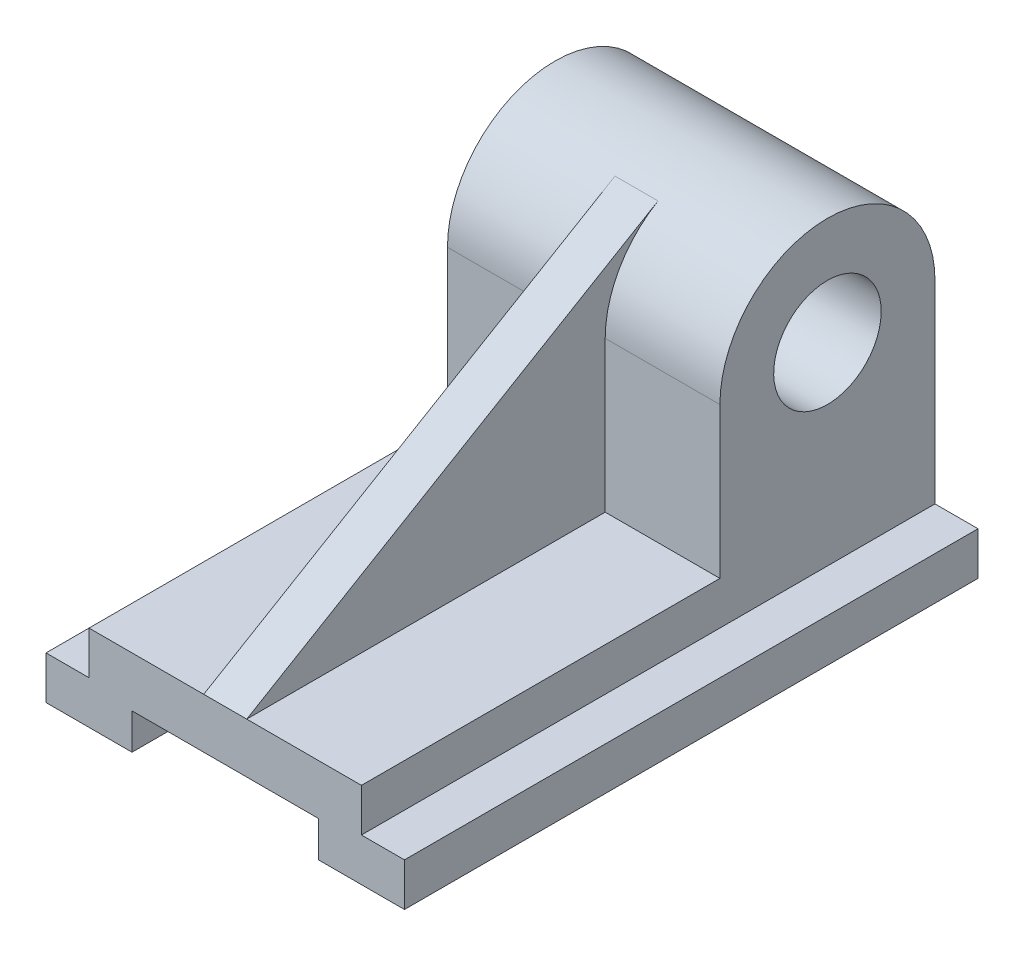
from build123d import *

# Parameters (mm, degrees)
BOSS_EXTRUDE1_DEPTH = 80
SKETCH2_W           = 76
SKETCH2_H           = 60
BOSS_EXTRUDE2_DEPTH = 42
SKETCH3_R           = 30
BOSS_EXTRUDE4_DEPTH = 76
SKETCH5_R           = 15
CUT_EXTRUDE3_DEPTH  = 146.602197786
RIB1_REACH          = 128.317
SKETCH6_WALL_W      = 387.915768988
SKETCH6_WALL_H      = 12


with BuildPart() as part:
    # Sketch1 → Boss-Extrude1 (new, symmetric)
    with BuildSketch(Plane.XY):
        Polygon((38, 12), (-38, 12), (-38, 0), (-50, 0), (-50, -12), (-26, -12), (-26, -2), (26, -2), (26, -12), (50, -12), (50, 0), (38, 0), align=None)
    extrude(amount=BOSS_EXTRUDE1_DEPTH, both=True)

    # Sketch2 → Boss-Extrude2 (add)
    with BuildSketch(Plane(origin=(0, 12, 0), x_dir=(1, 0, 0), z_dir=(0, 1, 0))):
        with Locations((0, 50)):
            Rectangle(SKETCH2_W, SKETCH2_H)
    extrude(amount=BOSS_EXTRUDE2_DEPTH)

    # Sketch3 → Boss-Extrude4 (add)
    with BuildSketch(Plane(origin=(38, 0, 0), x_dir=(0, 0, -1), z_dir=(1, 0, 0))):
        with Locations((50, 54)):
            Circle(SKETCH3_R)
    extrude(amount=-BOSS_EXTRUDE4_DEPTH)

    # Sketch5 → Cut-Extrude3 (cut, through all)
    with BuildSketch(Plane(origin=(38, 0, 0), x_dir=(0, 0, -1), z_dir=(1, 0, 0))):
        with Locations(Location((50, 54, 0), (0, 0, 90))):
            Circle(SKETCH5_R)
    extrude(amount=-CUT_EXTRUDE3_DEPTH, mode=Mode.SUBTRACT)

    # Sketch6 wall → Rib1 (add, up to next)
    with BuildSketch(Plane(origin=(0, 45.912515045, 22.633279453), x_dir=(0, 0.508884996751, -0.860834513761), z_dir=(0, 0.860834513761, 0.508884996751)), mode=Mode.PRIVATE) as rib1_sk1:
        Rectangle(SKETCH6_WALL_W, SKETCH6_WALL_H)
    rib1_tool1 = extrude(rib1_sk1.sketch, amount=-RIB1_REACH, mode=Mode.PRIVATE) - part.part
    add(rib1_tool1.solids().sort_by_distance((0, 45.912515045, 22.633279453))[0])


solid = part.part
